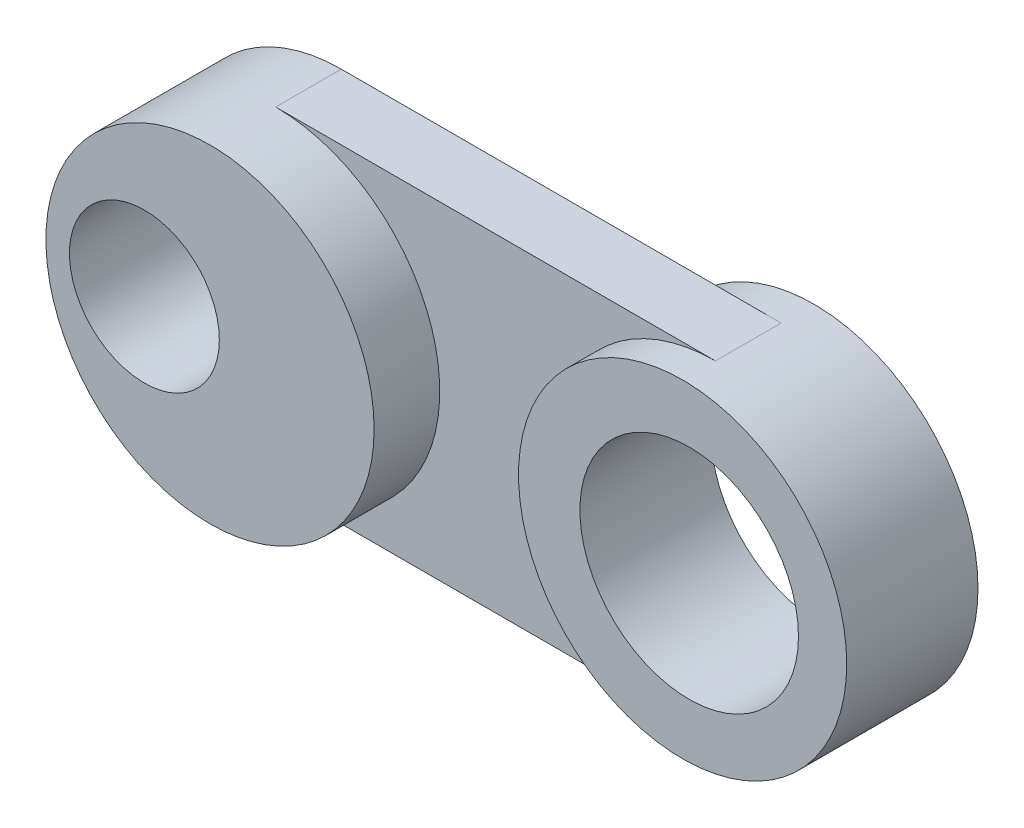
from build123d import *
from build123d.topology import SkipClean

# Parameters (mm, degrees)
SKETCH1_R           = 2.9
SKETCH1_R_2         = 4.2291
BOSS_EXTRUDE1_DEPTH = 1.27
BOSS_EXTRUDE2_START = 2.54
SKETCH2_R           = 2.9
BOSS_EXTRUDE2_DEPTH = 2.54
SKETCH4_R           = 6.35
SKETCH4_R_2         = 4.2291
BOSS_EXTRUDE4_DEPTH = 2.54


with BuildPart() as part:
    # Sketch1 → Boss-Extrude1 (new, symmetric)
    with BuildSketch(Plane.XY):
        with BuildLine():
            Line((0, 12.7), (17.018, 12.7))
            ThreePointArc((17.018, 12.7), (23.368, 6.35), (17.018, 0))
            Line((17.018, 0), (0, 0))
            ThreePointArc((0, 0), (-6.35, 6.35), (0, 12.7))
        make_face()
        with Locations((-2.54, 6.35)):
            Circle(SKETCH1_R, mode=Mode.SUBTRACT)
        with Locations((17.272, 6.35)):
            Circle(SKETCH1_R_2, mode=Mode.SUBTRACT)
    extrude(amount=BOSS_EXTRUDE1_DEPTH, both=True)

    # Sketch2 → Boss-Extrude2 (add)
    with SkipClean():  # the faces are left unmerged after this step: merging them gives an invalid solid
        with BuildSketch(Plane.XY.offset(1.27).offset(BOSS_EXTRUDE2_START)):
            with BuildLine():
                ThreePointArc((0, 0), (4.490128061, 1.859871939), (6.35, 6.35))
                ThreePointArc((6.35, 6.35), (4.490128061, 10.840128061), (0, 12.7))
                ThreePointArc((0, 12.7), (-6.35, 6.35), (0, 0))
            make_face()
            with Locations((-2.54, 6.35)):
                Circle(SKETCH2_R, mode=Mode.SUBTRACT)
        extrude(amount=-BOSS_EXTRUDE2_DEPTH)

    # Sketch4 → Boss-Extrude4 (add, symmetric)
    with SkipClean():  # the faces are left unmerged after this step: merging them gives an invalid solid
        with BuildSketch(Plane.XY):
            with Locations((17.018, 6.35)):
                Circle(SKETCH4_R)
            with Locations((17.272, 6.35)):
                Circle(SKETCH4_R_2, mode=Mode.SUBTRACT)
        extrude(amount=BOSS_EXTRUDE4_DEPTH, both=True)


solid = part.part
